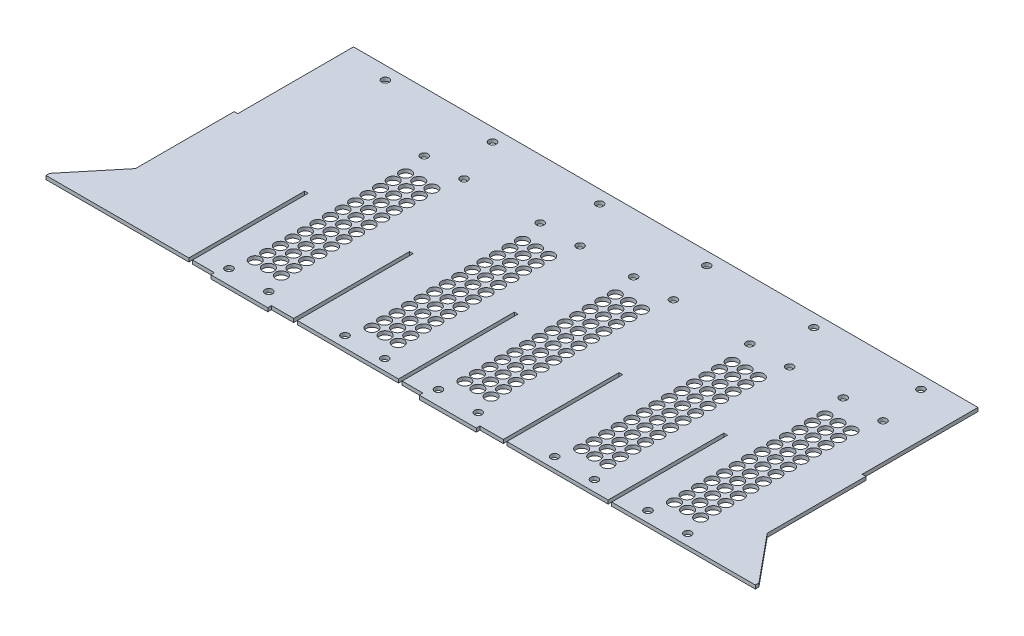
from build123d import *

# Parameters (mm, degrees)
SKETCH1_W                   = 554.2768632
SKETCH1_H                   = 3.175
BOSS_EXTRUDE1_DEPTH         = 232.6
SKETCH7_R                   = 3.302
CUT_EXTRUDE4_DEPTH          = 362.826686267
SKETCH6_W                   = 50
SKETCH6_H                   = 3.175
BOSS_EXTRUDE2_DEPTH         = 3.175
LPATTERN1_COUNT             = 6
LPATTERN1_PITCH             = 93.98
SKETCH2_W                   = 3.175
SKETCH2_H                   = 101.6
CUT_EXTRUDE5_DEPTH          = 364.878219969
BOSS_EXTRUDE3_DEPTH         = 3.175
SKETCH13_R                  = 5
CUT_EXTRUDE6_DEPTH          = 391.42435321
LPATTERN2_COUNT             = 3
LPATTERN2_PITCH             = 11.5
LPATTERN3_COUNT             = 13
LPATTERN3_PITCH             = 11
LPATTERN3_COPY_1_SKETCH_R   = 5
LPATTERN3_COPY_1_DEPTH      = 391.42435321
LPATTERN3_COPY_2_SKETCH_R   = 5
LPATTERN3_COPY_2_DEPTH      = 391.42435321
LPATTERN3_COPY_3_SKETCH_R   = 5
LPATTERN3_COPY_3_DEPTH      = 391.42435321
LPATTERN3_COPY_4_SKETCH_R   = 5
LPATTERN3_COPY_4_DEPTH      = 391.42435321
LPATTERN3_COPY_5_SKETCH_R   = 5
LPATTERN3_COPY_5_DEPTH      = 391.42435321
LPATTERN3_COPY_6_SKETCH_R   = 5
LPATTERN3_COPY_6_DEPTH      = 391.42435321
LPATTERN3_COPY_7_SKETCH_R   = 5
LPATTERN3_COPY_7_DEPTH      = 391.42435321
LPATTERN3_COPY_8_SKETCH_R   = 5
LPATTERN3_COPY_8_DEPTH      = 391.42435321
LPATTERN3_COPY_9_SKETCH_R   = 5
LPATTERN3_COPY_9_DEPTH      = 391.42435321
LPATTERN3_COPY_10_SKETCH_R  = 5
LPATTERN3_COPY_10_DEPTH     = 391.42435321
LPATTERN3_COPY_11_SKETCH_R  = 5
LPATTERN3_COPY_11_DEPTH     = 391.42435321
LPATTERN3_COPY_12_SKETCH_R  = 5
LPATTERN3_COPY_12_DEPTH     = 391.42435321
LPATTERN3_COPY_13_SKETCH_R  = 5
LPATTERN3_COPY_13_DEPTH     = 391.42435321
LPATTERN3_COPY_14_SKETCH_R  = 5
LPATTERN3_COPY_14_DEPTH     = 391.42435321
LPATTERN3_COPY_15_SKETCH_R  = 5
LPATTERN3_COPY_15_DEPTH     = 391.42435321
LPATTERN3_COPY_16_SKETCH_R  = 5
LPATTERN3_COPY_16_DEPTH     = 391.42435321
LPATTERN3_COPY_17_SKETCH_R  = 5
LPATTERN3_COPY_17_DEPTH     = 391.42435321
LPATTERN3_COPY_18_SKETCH_R  = 5
LPATTERN3_COPY_18_DEPTH     = 391.42435321
LPATTERN3_COPY_19_SKETCH_R  = 5
LPATTERN3_COPY_19_DEPTH     = 391.42435321
LPATTERN3_COPY_20_SKETCH_R  = 5
LPATTERN3_COPY_20_DEPTH     = 391.42435321
LPATTERN3_COPY_21_SKETCH_R  = 5
LPATTERN3_COPY_21_DEPTH     = 391.42435321
LPATTERN3_COPY_22_SKETCH_R  = 5
LPATTERN3_COPY_22_DEPTH     = 391.42435321
LPATTERN3_COPY_23_SKETCH_R  = 5
LPATTERN3_COPY_23_DEPTH     = 391.42435321
LPATTERN3_COPY_24_SKETCH_R  = 5
LPATTERN3_COPY_24_DEPTH     = 391.42435321
LPATTERN4_COUNT             = 3
LPATTERN4_PITCH             = 183.92
LPATTERN4_COPY_1_SKETCH_R   = 5
LPATTERN4_COPY_1_DEPTH      = 391.42435321
LPATTERN4_COPY_2_SKETCH_R   = 5
LPATTERN4_COPY_2_DEPTH      = 391.42435321
LPATTERN4_COPY_3_SKETCH_R   = 5
LPATTERN4_COPY_3_DEPTH      = 391.42435321
LPATTERN4_COPY_4_SKETCH_R   = 5
LPATTERN4_COPY_4_DEPTH      = 391.42435321
LPATTERN4_COPY_5_SKETCH_R   = 5
LPATTERN4_COPY_5_DEPTH      = 391.42435321
LPATTERN4_COPY_6_SKETCH_R   = 5
LPATTERN4_COPY_6_DEPTH      = 391.42435321
LPATTERN4_COPY_7_SKETCH_R   = 5
LPATTERN4_COPY_7_DEPTH      = 391.42435321
LPATTERN4_COPY_8_SKETCH_R   = 5
LPATTERN4_COPY_8_DEPTH      = 391.42435321
LPATTERN4_COPY_9_SKETCH_R   = 5
LPATTERN4_COPY_9_DEPTH      = 391.42435321
LPATTERN4_COPY_10_SKETCH_R  = 5
LPATTERN4_COPY_10_DEPTH     = 391.42435321
LPATTERN4_COPY_11_SKETCH_R  = 5
LPATTERN4_COPY_11_DEPTH     = 391.42435321
LPATTERN4_COPY_12_SKETCH_R  = 5
LPATTERN4_COPY_12_DEPTH     = 391.42435321
LPATTERN4_COPY_13_SKETCH_R  = 5
LPATTERN4_COPY_13_DEPTH     = 391.42435321
LPATTERN4_COPY_14_SKETCH_R  = 5
LPATTERN4_COPY_14_DEPTH     = 391.42435321
LPATTERN4_COPY_15_SKETCH_R  = 5
LPATTERN4_COPY_15_DEPTH     = 391.42435321
LPATTERN4_COPY_16_SKETCH_R  = 5
LPATTERN4_COPY_16_DEPTH     = 391.42435321
LPATTERN4_COPY_17_SKETCH_R  = 5
LPATTERN4_COPY_17_DEPTH     = 391.42435321
LPATTERN4_COPY_18_SKETCH_R  = 5
LPATTERN4_COPY_18_DEPTH     = 391.42435321
LPATTERN4_COPY_19_SKETCH_R  = 5
LPATTERN4_COPY_19_DEPTH     = 391.42435321
LPATTERN4_COPY_20_SKETCH_R  = 5
LPATTERN4_COPY_20_DEPTH     = 391.42435321
LPATTERN4_COPY_21_SKETCH_R  = 5
LPATTERN4_COPY_21_DEPTH     = 391.42435321
LPATTERN4_COPY_22_SKETCH_R  = 5
LPATTERN4_COPY_22_DEPTH     = 391.42435321
LPATTERN4_COPY_23_SKETCH_R  = 5
LPATTERN4_COPY_23_DEPTH     = 391.42435321
LPATTERN4_COPY_24_SKETCH_R  = 5
LPATTERN4_COPY_24_DEPTH     = 391.42435321
LPATTERN4_COPY_25_SKETCH_R  = 5
LPATTERN4_COPY_25_DEPTH     = 391.42435321
LPATTERN4_COPY_26_SKETCH_R  = 5
LPATTERN4_COPY_26_DEPTH     = 391.42435321
LPATTERN4_COPY_27_SKETCH_R  = 5
LPATTERN4_COPY_27_DEPTH     = 391.42435321
LPATTERN4_COPY_28_SKETCH_R  = 5
LPATTERN4_COPY_28_DEPTH     = 391.42435321
LPATTERN4_COPY_29_SKETCH_R  = 5
LPATTERN4_COPY_29_DEPTH     = 391.42435321
LPATTERN4_COPY_30_SKETCH_R  = 5
LPATTERN4_COPY_30_DEPTH     = 391.42435321
LPATTERN4_COPY_31_SKETCH_R  = 5
LPATTERN4_COPY_31_DEPTH     = 391.42435321
LPATTERN4_COPY_32_SKETCH_R  = 5
LPATTERN4_COPY_32_DEPTH     = 391.42435321
LPATTERN4_COPY_33_SKETCH_R  = 5
LPATTERN4_COPY_33_DEPTH     = 391.42435321
LPATTERN4_COPY_34_SKETCH_R  = 5
LPATTERN4_COPY_34_DEPTH     = 391.42435321
LPATTERN4_COPY_35_SKETCH_R  = 5
LPATTERN4_COPY_35_DEPTH     = 391.42435321
LPATTERN4_COPY_36_SKETCH_R  = 5
LPATTERN4_COPY_36_DEPTH     = 391.42435321
LPATTERN4_COPY_37_SKETCH_R  = 5
LPATTERN4_COPY_37_DEPTH     = 391.42435321
LPATTERN4_COPY_38_SKETCH_R  = 5
LPATTERN4_COPY_38_DEPTH     = 391.42435321
LPATTERN4_COPY_39_SKETCH_R  = 5
LPATTERN4_COPY_39_DEPTH     = 391.42435321
LPATTERN4_COPY_40_SKETCH_R  = 5
LPATTERN4_COPY_40_DEPTH     = 391.42435321
LPATTERN4_COPY_41_SKETCH_R  = 5
LPATTERN4_COPY_41_DEPTH     = 391.42435321
LPATTERN4_COPY_42_SKETCH_R  = 5
LPATTERN4_COPY_42_DEPTH     = 391.42435321
LPATTERN4_COPY_43_SKETCH_R  = 5
LPATTERN4_COPY_43_DEPTH     = 391.42435321
LPATTERN4_COPY_44_SKETCH_R  = 5
LPATTERN4_COPY_44_DEPTH     = 391.42435321
LPATTERN4_COPY_45_SKETCH_R  = 5
LPATTERN4_COPY_45_DEPTH     = 391.42435321
LPATTERN4_COPY_46_SKETCH_R  = 5
LPATTERN4_COPY_46_DEPTH     = 391.42435321
LPATTERN4_COPY_47_SKETCH_R  = 5
LPATTERN4_COPY_47_DEPTH     = 391.42435321
LPATTERN4_COPY_48_SKETCH_R  = 5
LPATTERN4_COPY_48_DEPTH     = 391.42435321
LPATTERN4_COPY_49_SKETCH_R  = 5
LPATTERN4_COPY_49_DEPTH     = 391.42435321
LPATTERN4_COPY_50_SKETCH_R  = 5
LPATTERN4_COPY_50_DEPTH     = 391.42435321
LPATTERN4_COPY_51_SKETCH_R  = 5
LPATTERN4_COPY_51_DEPTH     = 391.42435321
LPATTERN4_COPY_52_SKETCH_R  = 5
LPATTERN4_COPY_52_DEPTH     = 391.42435321
LPATTERN4_COPY_53_SKETCH_R  = 5
LPATTERN4_COPY_53_DEPTH     = 391.42435321
LPATTERN4_COPY_54_SKETCH_R  = 5
LPATTERN4_COPY_54_DEPTH     = 391.42435321
LPATTERN4_COPY_55_SKETCH_R  = 5
LPATTERN4_COPY_55_DEPTH     = 391.42435321
LPATTERN4_COPY_56_SKETCH_R  = 5
LPATTERN4_COPY_56_DEPTH     = 391.42435321
LPATTERN4_COPY_57_SKETCH_R  = 5
LPATTERN4_COPY_57_DEPTH     = 391.42435321
LPATTERN4_COPY_58_SKETCH_R  = 5
LPATTERN4_COPY_58_DEPTH     = 391.42435321
LPATTERN4_COPY_59_SKETCH_R  = 5
LPATTERN4_COPY_59_DEPTH     = 391.42435321
LPATTERN4_COPY_60_SKETCH_R  = 5
LPATTERN4_COPY_60_DEPTH     = 391.42435321
LPATTERN4_COPY_61_SKETCH_R  = 5
LPATTERN4_COPY_61_DEPTH     = 391.42435321
LPATTERN4_COPY_62_SKETCH_R  = 5
LPATTERN4_COPY_62_DEPTH     = 391.42435321
LPATTERN4_COPY_63_SKETCH_R  = 5
LPATTERN4_COPY_63_DEPTH     = 391.42435321
LPATTERN4_COPY_64_SKETCH_R  = 5
LPATTERN4_COPY_64_DEPTH     = 391.42435321
LPATTERN4_COPY_65_SKETCH_R  = 5
LPATTERN4_COPY_65_DEPTH     = 391.42435321
LPATTERN4_COPY_66_SKETCH_R  = 5
LPATTERN4_COPY_66_DEPTH     = 391.42435321
LPATTERN4_COPY_67_SKETCH_R  = 5
LPATTERN4_COPY_67_DEPTH     = 391.42435321
LPATTERN4_COPY_68_SKETCH_R  = 5
LPATTERN4_COPY_68_DEPTH     = 391.42435321
LPATTERN4_COPY_69_SKETCH_R  = 5
LPATTERN4_COPY_69_DEPTH     = 391.42435321
LPATTERN4_COPY_70_SKETCH_R  = 5
LPATTERN4_COPY_70_DEPTH     = 391.42435321
LPATTERN4_COPY_71_SKETCH_R  = 5
LPATTERN4_COPY_71_DEPTH     = 391.42435321
LPATTERN4_COPY_72_SKETCH_R  = 5
LPATTERN4_COPY_72_DEPTH     = 391.42435321
LPATTERN4_COPY_73_SKETCH_R  = 5
LPATTERN4_COPY_73_DEPTH     = 391.42435321
LPATTERN4_COPY_74_SKETCH_R  = 5
LPATTERN4_COPY_74_DEPTH     = 391.42435321
LPATTERN4_COPY_75_SKETCH_R  = 5
LPATTERN4_COPY_75_DEPTH     = 391.42435321
LPATTERN4_COPY_76_SKETCH_R  = 5
LPATTERN4_COPY_76_DEPTH     = 391.42435321
SKETCH14_W                  = 3.175
SKETCH14_H                  = 101.6
CUT_EXTRUDE7_DEPTH          = 391.42435321
LPATTERN7_COUNT             = 5
LPATTERN7_PITCH             = 91.9550104
SKETCH21_R                  = 5
CUT_EXTRUDE8_DEPTH          = 391.42435321
LPATTERN10_COUNT            = 13
LPATTERN10_PITCH            = 11
LPATTERN11_COUNT            = 2
LPATTERN11_PITCH            = 183.92
LPATTERN11_COPY_1_SKETCH_R  = 5
LPATTERN11_COPY_1_DEPTH     = 391.42435321
LPATTERN11_COPY_2_SKETCH_R  = 5
LPATTERN11_COPY_2_DEPTH     = 391.42435321
LPATTERN11_COPY_3_SKETCH_R  = 5
LPATTERN11_COPY_3_DEPTH     = 391.42435321
LPATTERN11_COPY_4_SKETCH_R  = 5
LPATTERN11_COPY_4_DEPTH     = 391.42435321
LPATTERN11_COPY_5_SKETCH_R  = 5
LPATTERN11_COPY_5_DEPTH     = 391.42435321
LPATTERN11_COPY_6_SKETCH_R  = 5
LPATTERN11_COPY_6_DEPTH     = 391.42435321
LPATTERN11_COPY_7_SKETCH_R  = 5
LPATTERN11_COPY_7_DEPTH     = 391.42435321
LPATTERN11_COPY_8_SKETCH_R  = 5
LPATTERN11_COPY_8_DEPTH     = 391.42435321
LPATTERN11_COPY_9_SKETCH_R  = 5
LPATTERN11_COPY_9_DEPTH     = 391.42435321
LPATTERN11_COPY_10_SKETCH_R = 5
LPATTERN11_COPY_10_DEPTH    = 391.42435321
LPATTERN11_COPY_11_SKETCH_R = 5
LPATTERN11_COPY_11_DEPTH    = 391.42435321
LPATTERN11_COPY_12_SKETCH_R = 5
LPATTERN11_COPY_12_DEPTH    = 391.42435321
M6_CLEARANCE_HOLE2_D        = 6.6
LPATTERN12_COUNT            = 2
LPATTERN12_PITCH            = 183.896
M6_CLEARANCE_HOLE3_D        = 6.6


with BuildPart() as part:
    # Sketch1 → Boss-Extrude1 (new body)
    with BuildSketch(Plane.XY):
        Rectangle(SKETCH1_W, SKETCH1_H)
    extrude(amount=BOSS_EXTRUDE1_DEPTH)

    # Sketch7 → Cut-Extrude4 (cut, through all)
    with BuildSketch(Plane(origin=(0, -1.5875, 0), x_dir=(-1, 0, 0), z_dir=(0, -1, 0))):
        with Locations(Location((-235.2284316, -11.29165, 0), (0, 0, 90))):
            Circle(SKETCH7_R)
    cut_extrude4 = extrude(amount=-CUT_EXTRUDE4_DEPTH, mode=Mode.SUBTRACT)

    # Sketch6 → Boss-Extrude2 (add)
    with BuildSketch(Plane.XY.offset(232.6)):
        with Locations((-138.4246374, 0)):
            Rectangle(SKETCH6_W, SKETCH6_H)
        Polygon((69.533389644, -1.5875), (69.533389644, 1.5875), (19.533389644, 1.5875), (19.533389644, -1.847332285), align=None)
    extrude(amount=BOSS_EXTRUDE2_DEPTH)

    # LPattern1: Cut-Extrude4 ×6
    with Locations(*[(-i * LPATTERN1_PITCH, 0, 0) for i in range(1, LPATTERN1_COUNT)]):
        add(cut_extrude4, mode=Mode.SUBTRACT)

    # Sketch2 → Cut-Extrude5 (cut, through all)
    with BuildSketch(Plane(origin=(0, 1.5875, 0), x_dir=(1, 0, 0), z_dir=(0, 1, 0))):
        with Locations((-275.5509316, -50.8)):
            Rectangle(SKETCH2_W, SKETCH2_H)
        with Locations((275.5509316, -50.8)):
            Rectangle(SKETCH2_W, SKETCH2_H)
    extrude(amount=-CUT_EXTRUDE5_DEPTH, mode=Mode.SUBTRACT)

    # Sketch12 → Boss-Extrude3 (add)
    with BuildSketch(Plane(origin=(0, 1.5875, 0), x_dir=(1, 0, 0), z_dir=(0, 1, 0))):
        Polygon((-311.1744316, -232.6), (-277.1384316, -232.6), (-277.1384316, -188.15), (-311.1744316, -229.425), align=None)
    boss_extrude3 = extrude(amount=-BOSS_EXTRUDE3_DEPTH)

    # Mirror1: Boss-Extrude3 across plane
    add(boss_extrude3.mirror(Plane(origin=(0, 0, 0), x_dir=(0, 0, 1), z_dir=(1, 0, 0))))

    # Sketch13 → Cut-Extrude6 (cut, through all)
    with BuildSketch(Plane(origin=(0, 1.5875, 0), x_dir=(1, 0, 0), z_dir=(0, 1, 0))):
        with Locations(Location((-154.856502919, -73.343337061, 0), (0, 0, 270))):
            Circle(SKETCH13_R)
    cut_extrude6 = extrude(amount=-CUT_EXTRUDE6_DEPTH, mode=Mode.SUBTRACT)

    # LPattern2: Cut-Extrude6 ×3
    with Locations(*[(i * LPATTERN2_PITCH, 0, 0) for i in range(1, LPATTERN2_COUNT)]):
        add(cut_extrude6, mode=Mode.SUBTRACT)

    # LPattern3: Cut-Extrude6 ×13
    with Locations(*[(0, 0, i * LPATTERN3_PITCH) for i in range(1, LPATTERN3_COUNT)]):
        add(cut_extrude6, mode=Mode.SUBTRACT)

    # LPattern3 copy 1 sketch → LPattern3 copy 1 (cut, through all)
    with BuildSketch(Plane(origin=(11.5, 1.5875, 11), x_dir=(1, 0, 0), z_dir=(0, 1, 0))):
        with Locations(Location((-154.856502919, -73.343337061, 0), (0, 0, 270))):
            Circle(LPATTERN3_COPY_1_SKETCH_R)
    extrude(amount=-LPATTERN3_COPY_1_DEPTH, mode=Mode.SUBTRACT)

    # LPattern3 copy 2 sketch → LPattern3 copy 2 (cut, through all)
    with BuildSketch(Plane(origin=(11.5, 1.5875, 22), x_dir=(1, 0, 0), z_dir=(0, 1, 0))):
        with Locations(Location((-154.856502919, -73.343337061, 0), (0, 0, 270))):
            Circle(LPATTERN3_COPY_2_SKETCH_R)
    extrude(amount=-LPATTERN3_COPY_2_DEPTH, mode=Mode.SUBTRACT)

    # LPattern3 copy 3 sketch → LPattern3 copy 3 (cut, through all)
    with BuildSketch(Plane(origin=(11.5, 1.5875, 33), x_dir=(1, 0, 0), z_dir=(0, 1, 0))):
        with Locations(Location((-154.856502919, -73.343337061, 0), (0, 0, 270))):
            Circle(LPATTERN3_COPY_3_SKETCH_R)
    extrude(amount=-LPATTERN3_COPY_3_DEPTH, mode=Mode.SUBTRACT)

    # LPattern3 copy 4 sketch → LPattern3 copy 4 (cut, through all)
    with BuildSketch(Plane(origin=(11.5, 1.5875, 44), x_dir=(1, 0, 0), z_dir=(0, 1, 0))):
        with Locations(Location((-154.856502919, -73.343337061, 0), (0, 0, 270))):
            Circle(LPATTERN3_COPY_4_SKETCH_R)
    extrude(amount=-LPATTERN3_COPY_4_DEPTH, mode=Mode.SUBTRACT)

    # LPattern3 copy 5 sketch → LPattern3 copy 5 (cut, through all)
    with BuildSketch(Plane(origin=(11.5, 1.5875, 55), x_dir=(1, 0, 0), z_dir=(0, 1, 0))):
        with Locations(Location((-154.856502919, -73.343337061, 0), (0, 0, 270))):
            Circle(LPATTERN3_COPY_5_SKETCH_R)
    extrude(amount=-LPATTERN3_COPY_5_DEPTH, mode=Mode.SUBTRACT)

    # LPattern3 copy 6 sketch → LPattern3 copy 6 (cut, through all)
    with BuildSketch(Plane(origin=(11.5, 1.5875, 66), x_dir=(1, 0, 0), z_dir=(0, 1, 0))):
        with Locations(Location((-154.856502919, -73.343337061, 0), (0, 0, 270))):
            Circle(LPATTERN3_COPY_6_SKETCH_R)
    extrude(amount=-LPATTERN3_COPY_6_DEPTH, mode=Mode.SUBTRACT)

    # LPattern3 copy 7 sketch → LPattern3 copy 7 (cut, through all)
    with BuildSketch(Plane(origin=(11.5, 1.5875, 77), x_dir=(1, 0, 0), z_dir=(0, 1, 0))):
        with Locations(Location((-154.856502919, -73.343337061, 0), (0, 0, 270))):
            Circle(LPATTERN3_COPY_7_SKETCH_R)
    extrude(amount=-LPATTERN3_COPY_7_DEPTH, mode=Mode.SUBTRACT)

    # LPattern3 copy 8 sketch → LPattern3 copy 8 (cut, through all)
    with BuildSketch(Plane(origin=(11.5, 1.5875, 88), x_dir=(1, 0, 0), z_dir=(0, 1, 0))):
        with Locations(Location((-154.856502919, -73.343337061, 0), (0, 0, 270))):
            Circle(LPATTERN3_COPY_8_SKETCH_R)
    extrude(amount=-LPATTERN3_COPY_8_DEPTH, mode=Mode.SUBTRACT)

    # LPattern3 copy 9 sketch → LPattern3 copy 9 (cut, through all)
    with BuildSketch(Plane(origin=(11.5, 1.5875, 99), x_dir=(1, 0, 0), z_dir=(0, 1, 0))):
        with Locations(Location((-154.856502919, -73.343337061, 0), (0, 0, 270))):
            Circle(LPATTERN3_COPY_9_SKETCH_R)
    extrude(amount=-LPATTERN3_COPY_9_DEPTH, mode=Mode.SUBTRACT)

    # LPattern3 copy 10 sketch → LPattern3 copy 10 (cut, through all)
    with BuildSketch(Plane(origin=(11.5, 1.5875, 110), x_dir=(1, 0, 0), z_dir=(0, 1, 0))):
        with Locations(Location((-154.856502919, -73.343337061, 0), (0, 0, 270))):
            Circle(LPATTERN3_COPY_10_SKETCH_R)
    extrude(amount=-LPATTERN3_COPY_10_DEPTH, mode=Mode.SUBTRACT)

    # LPattern3 copy 11 sketch → LPattern3 copy 11 (cut, through all)
    with BuildSketch(Plane(origin=(11.5, 1.5875, 121), x_dir=(1, 0, 0), z_dir=(0, 1, 0))):
        with Locations(Location((-154.856502919, -73.343337061, 0), (0, 0, 270))):
            Circle(LPATTERN3_COPY_11_SKETCH_R)
    extrude(amount=-LPATTERN3_COPY_11_DEPTH, mode=Mode.SUBTRACT)

    # LPattern3 copy 12 sketch → LPattern3 copy 12 (cut, through all)
    with BuildSketch(Plane(origin=(11.5, 1.5875, 132), x_dir=(1, 0, 0), z_dir=(0, 1, 0))):
        with Locations(Location((-154.856502919, -73.343337061, 0), (0, 0, 270))):
            Circle(LPATTERN3_COPY_12_SKETCH_R)
    extrude(amount=-LPATTERN3_COPY_12_DEPTH, mode=Mode.SUBTRACT)

    # LPattern3 copy 13 sketch → LPattern3 copy 13 (cut, through all)
    with BuildSketch(Plane(origin=(23, 1.5875, 11), x_dir=(1, 0, 0), z_dir=(0, 1, 0))):
        with Locations(Location((-154.856502919, -73.343337061, 0), (0, 0, 270))):
            Circle(LPATTERN3_COPY_13_SKETCH_R)
    extrude(amount=-LPATTERN3_COPY_13_DEPTH, mode=Mode.SUBTRACT)

    # LPattern3 copy 14 sketch → LPattern3 copy 14 (cut, through all)
    with BuildSketch(Plane(origin=(23, 1.5875, 22), x_dir=(1, 0, 0), z_dir=(0, 1, 0))):
        with Locations(Location((-154.856502919, -73.343337061, 0), (0, 0, 270))):
            Circle(LPATTERN3_COPY_14_SKETCH_R)
    extrude(amount=-LPATTERN3_COPY_14_DEPTH, mode=Mode.SUBTRACT)

    # LPattern3 copy 15 sketch → LPattern3 copy 15 (cut, through all)
    with BuildSketch(Plane(origin=(23, 1.5875, 33), x_dir=(1, 0, 0), z_dir=(0, 1, 0))):
        with Locations(Location((-154.856502919, -73.343337061, 0), (0, 0, 270))):
            Circle(LPATTERN3_COPY_15_SKETCH_R)
    extrude(amount=-LPATTERN3_COPY_15_DEPTH, mode=Mode.SUBTRACT)

    # LPattern3 copy 16 sketch → LPattern3 copy 16 (cut, through all)
    with BuildSketch(Plane(origin=(23, 1.5875, 44), x_dir=(1, 0, 0), z_dir=(0, 1, 0))):
        with Locations(Location((-154.856502919, -73.343337061, 0), (0, 0, 270))):
            Circle(LPATTERN3_COPY_16_SKETCH_R)
    extrude(amount=-LPATTERN3_COPY_16_DEPTH, mode=Mode.SUBTRACT)

    # LPattern3 copy 17 sketch → LPattern3 copy 17 (cut, through all)
    with BuildSketch(Plane(origin=(23, 1.5875, 55), x_dir=(1, 0, 0), z_dir=(0, 1, 0))):
        with Locations(Location((-154.856502919, -73.343337061, 0), (0, 0, 270))):
            Circle(LPATTERN3_COPY_17_SKETCH_R)
    extrude(amount=-LPATTERN3_COPY_17_DEPTH, mode=Mode.SUBTRACT)

    # LPattern3 copy 18 sketch → LPattern3 copy 18 (cut, through all)
    with BuildSketch(Plane(origin=(23, 1.5875, 66), x_dir=(1, 0, 0), z_dir=(0, 1, 0))):
        with Locations(Location((-154.856502919, -73.343337061, 0), (0, 0, 270))):
            Circle(LPATTERN3_COPY_18_SKETCH_R)
    extrude(amount=-LPATTERN3_COPY_18_DEPTH, mode=Mode.SUBTRACT)

    # LPattern3 copy 19 sketch → LPattern3 copy 19 (cut, through all)
    with BuildSketch(Plane(origin=(23, 1.5875, 77), x_dir=(1, 0, 0), z_dir=(0, 1, 0))):
        with Locations(Location((-154.856502919, -73.343337061, 0), (0, 0, 270))):
            Circle(LPATTERN3_COPY_19_SKETCH_R)
    extrude(amount=-LPATTERN3_COPY_19_DEPTH, mode=Mode.SUBTRACT)

    # LPattern3 copy 20 sketch → LPattern3 copy 20 (cut, through all)
    with BuildSketch(Plane(origin=(23, 1.5875, 88), x_dir=(1, 0, 0), z_dir=(0, 1, 0))):
        with Locations(Location((-154.856502919, -73.343337061, 0), (0, 0, 270))):
            Circle(LPATTERN3_COPY_20_SKETCH_R)
    extrude(amount=-LPATTERN3_COPY_20_DEPTH, mode=Mode.SUBTRACT)

    # LPattern3 copy 21 sketch → LPattern3 copy 21 (cut, through all)
    with BuildSketch(Plane(origin=(23, 1.5875, 99), x_dir=(1, 0, 0), z_dir=(0, 1, 0))):
        with Locations(Location((-154.856502919, -73.343337061, 0), (0, 0, 270))):
            Circle(LPATTERN3_COPY_21_SKETCH_R)
    extrude(amount=-LPATTERN3_COPY_21_DEPTH, mode=Mode.SUBTRACT)

    # LPattern3 copy 22 sketch → LPattern3 copy 22 (cut, through all)
    with BuildSketch(Plane(origin=(23, 1.5875, 110), x_dir=(1, 0, 0), z_dir=(0, 1, 0))):
        with Locations(Location((-154.856502919, -73.343337061, 0), (0, 0, 270))):
            Circle(LPATTERN3_COPY_22_SKETCH_R)
    extrude(amount=-LPATTERN3_COPY_22_DEPTH, mode=Mode.SUBTRACT)

    # LPattern3 copy 23 sketch → LPattern3 copy 23 (cut, through all)
    with BuildSketch(Plane(origin=(23, 1.5875, 121), x_dir=(1, 0, 0), z_dir=(0, 1, 0))):
        with Locations(Location((-154.856502919, -73.343337061, 0), (0, 0, 270))):
            Circle(LPATTERN3_COPY_23_SKETCH_R)
    extrude(amount=-LPATTERN3_COPY_23_DEPTH, mode=Mode.SUBTRACT)

    # LPattern3 copy 24 sketch → LPattern3 copy 24 (cut, through all)
    with BuildSketch(Plane(origin=(23, 1.5875, 132), x_dir=(1, 0, 0), z_dir=(0, 1, 0))):
        with Locations(Location((-154.856502919, -73.343337061, 0), (0, 0, 270))):
            Circle(LPATTERN3_COPY_24_SKETCH_R)
    extrude(amount=-LPATTERN3_COPY_24_DEPTH, mode=Mode.SUBTRACT)

    # LPattern4: Cut-Extrude6 ×3
    with Locations(*[(i * LPATTERN4_PITCH, 0, 0) for i in range(1, LPATTERN4_COUNT)]):
        add(cut_extrude6, mode=Mode.SUBTRACT)

    # LPattern4 copy 1 sketch → LPattern4 copy 1 (cut, through all)
    with BuildSketch(Plane(origin=(195.42, 1.5875, 0), x_dir=(1, 0, 0), z_dir=(0, 1, 0))):
        with Locations(Location((-154.856502919, -73.343337061, 0), (0, 0, 270))):
            Circle(LPATTERN4_COPY_1_SKETCH_R)
    extrude(amount=-LPATTERN4_COPY_1_DEPTH, mode=Mode.SUBTRACT)

    # LPattern4 copy 2 sketch → LPattern4 copy 2 (cut, through all)
    with BuildSketch(Plane(origin=(379.34, 1.5875, 0), x_dir=(1, 0, 0), z_dir=(0, 1, 0))):
        with Locations(Location((-154.856502919, -73.343337061, 0), (0, 0, 270))):
            Circle(LPATTERN4_COPY_2_SKETCH_R)
    extrude(amount=-LPATTERN4_COPY_2_DEPTH, mode=Mode.SUBTRACT)

    # LPattern4 copy 3 sketch → LPattern4 copy 3 (cut, through all)
    with BuildSketch(Plane(origin=(206.92, 1.5875, 0), x_dir=(1, 0, 0), z_dir=(0, 1, 0))):
        with Locations(Location((-154.856502919, -73.343337061, 0), (0, 0, 270))):
            Circle(LPATTERN4_COPY_3_SKETCH_R)
    extrude(amount=-LPATTERN4_COPY_3_DEPTH, mode=Mode.SUBTRACT)

    # LPattern4 copy 4 sketch → LPattern4 copy 4 (cut, through all)
    with BuildSketch(Plane(origin=(390.84, 1.5875, 0), x_dir=(1, 0, 0), z_dir=(0, 1, 0))):
        with Locations(Location((-154.856502919, -73.343337061, 0), (0, 0, 270))):
            Circle(LPATTERN4_COPY_4_SKETCH_R)
    extrude(amount=-LPATTERN4_COPY_4_DEPTH, mode=Mode.SUBTRACT)

    # LPattern4 copy 5 sketch → LPattern4 copy 5 (cut, through all)
    with BuildSketch(Plane(origin=(183.92, 1.5875, 11), x_dir=(1, 0, 0), z_dir=(0, 1, 0))):
        with Locations(Location((-154.856502919, -73.343337061, 0), (0, 0, 270))):
            Circle(LPATTERN4_COPY_5_SKETCH_R)
    extrude(amount=-LPATTERN4_COPY_5_DEPTH, mode=Mode.SUBTRACT)

    # LPattern4 copy 6 sketch → LPattern4 copy 6 (cut, through all)
    with BuildSketch(Plane(origin=(367.84, 1.5875, 11), x_dir=(1, 0, 0), z_dir=(0, 1, 0))):
        with Locations(Location((-154.856502919, -73.343337061, 0), (0, 0, 270))):
            Circle(LPATTERN4_COPY_6_SKETCH_R)
    extrude(amount=-LPATTERN4_COPY_6_DEPTH, mode=Mode.SUBTRACT)

    # LPattern4 copy 7 sketch → LPattern4 copy 7 (cut, through all)
    with BuildSketch(Plane(origin=(183.92, 1.5875, 22), x_dir=(1, 0, 0), z_dir=(0, 1, 0))):
        with Locations(Location((-154.856502919, -73.343337061, 0), (0, 0, 270))):
            Circle(LPATTERN4_COPY_7_SKETCH_R)
    extrude(amount=-LPATTERN4_COPY_7_DEPTH, mode=Mode.SUBTRACT)

    # LPattern4 copy 8 sketch → LPattern4 copy 8 (cut, through all)
    with BuildSketch(Plane(origin=(367.84, 1.5875, 22), x_dir=(1, 0, 0), z_dir=(0, 1, 0))):
        with Locations(Location((-154.856502919, -73.343337061, 0), (0, 0, 270))):
            Circle(LPATTERN4_COPY_8_SKETCH_R)
    extrude(amount=-LPATTERN4_COPY_8_DEPTH, mode=Mode.SUBTRACT)

    # LPattern4 copy 9 sketch → LPattern4 copy 9 (cut, through all)
    with BuildSketch(Plane(origin=(183.92, 1.5875, 33), x_dir=(1, 0, 0), z_dir=(0, 1, 0))):
        with Locations(Location((-154.856502919, -73.343337061, 0), (0, 0, 270))):
            Circle(LPATTERN4_COPY_9_SKETCH_R)
    extrude(amount=-LPATTERN4_COPY_9_DEPTH, mode=Mode.SUBTRACT)

    # LPattern4 copy 10 sketch → LPattern4 copy 10 (cut, through all)
    with BuildSketch(Plane(origin=(367.84, 1.5875, 33), x_dir=(1, 0, 0), z_dir=(0, 1, 0))):
        with Locations(Location((-154.856502919, -73.343337061, 0), (0, 0, 270))):
            Circle(LPATTERN4_COPY_10_SKETCH_R)
    extrude(amount=-LPATTERN4_COPY_10_DEPTH, mode=Mode.SUBTRACT)

    # LPattern4 copy 11 sketch → LPattern4 copy 11 (cut, through all)
    with BuildSketch(Plane(origin=(183.92, 1.5875, 44), x_dir=(1, 0, 0), z_dir=(0, 1, 0))):
        with Locations(Location((-154.856502919, -73.343337061, 0), (0, 0, 270))):
            Circle(LPATTERN4_COPY_11_SKETCH_R)
    extrude(amount=-LPATTERN4_COPY_11_DEPTH, mode=Mode.SUBTRACT)

    # LPattern4 copy 12 sketch → LPattern4 copy 12 (cut, through all)
    with BuildSketch(Plane(origin=(367.84, 1.5875, 44), x_dir=(1, 0, 0), z_dir=(0, 1, 0))):
        with Locations(Location((-154.856502919, -73.343337061, 0), (0, 0, 270))):
            Circle(LPATTERN4_COPY_12_SKETCH_R)
    extrude(amount=-LPATTERN4_COPY_12_DEPTH, mode=Mode.SUBTRACT)

    # LPattern4 copy 13 sketch → LPattern4 copy 13 (cut, through all)
    with BuildSketch(Plane(origin=(183.92, 1.5875, 55), x_dir=(1, 0, 0), z_dir=(0, 1, 0))):
        with Locations(Location((-154.856502919, -73.343337061, 0), (0, 0, 270))):
            Circle(LPATTERN4_COPY_13_SKETCH_R)
    extrude(amount=-LPATTERN4_COPY_13_DEPTH, mode=Mode.SUBTRACT)

    # LPattern4 copy 14 sketch → LPattern4 copy 14 (cut, through all)
    with BuildSketch(Plane(origin=(367.84, 1.5875, 55), x_dir=(1, 0, 0), z_dir=(0, 1, 0))):
        with Locations(Location((-154.856502919, -73.343337061, 0), (0, 0, 270))):
            Circle(LPATTERN4_COPY_14_SKETCH_R)
    extrude(amount=-LPATTERN4_COPY_14_DEPTH, mode=Mode.SUBTRACT)

    # LPattern4 copy 15 sketch → LPattern4 copy 15 (cut, through all)
    with BuildSketch(Plane(origin=(183.92, 1.5875, 66), x_dir=(1, 0, 0), z_dir=(0, 1, 0))):
        with Locations(Location((-154.856502919, -73.343337061, 0), (0, 0, 270))):
            Circle(LPATTERN4_COPY_15_SKETCH_R)
    extrude(amount=-LPATTERN4_COPY_15_DEPTH, mode=Mode.SUBTRACT)

    # LPattern4 copy 16 sketch → LPattern4 copy 16 (cut, through all)
    with BuildSketch(Plane(origin=(367.84, 1.5875, 66), x_dir=(1, 0, 0), z_dir=(0, 1, 0))):
        with Locations(Location((-154.856502919, -73.343337061, 0), (0, 0, 270))):
            Circle(LPATTERN4_COPY_16_SKETCH_R)
    extrude(amount=-LPATTERN4_COPY_16_DEPTH, mode=Mode.SUBTRACT)

    # LPattern4 copy 17 sketch → LPattern4 copy 17 (cut, through all)
    with BuildSketch(Plane(origin=(183.92, 1.5875, 77), x_dir=(1, 0, 0), z_dir=(0, 1, 0))):
        with Locations(Location((-154.856502919, -73.343337061, 0), (0, 0, 270))):
            Circle(LPATTERN4_COPY_17_SKETCH_R)
    extrude(amount=-LPATTERN4_COPY_17_DEPTH, mode=Mode.SUBTRACT)

    # LPattern4 copy 18 sketch → LPattern4 copy 18 (cut, through all)
    with BuildSketch(Plane(origin=(367.84, 1.5875, 77), x_dir=(1, 0, 0), z_dir=(0, 1, 0))):
        with Locations(Location((-154.856502919, -73.343337061, 0), (0, 0, 270))):
            Circle(LPATTERN4_COPY_18_SKETCH_R)
    extrude(amount=-LPATTERN4_COPY_18_DEPTH, mode=Mode.SUBTRACT)

    # LPattern4 copy 19 sketch → LPattern4 copy 19 (cut, through all)
    with BuildSketch(Plane(origin=(183.92, 1.5875, 88), x_dir=(1, 0, 0), z_dir=(0, 1, 0))):
        with Locations(Location((-154.856502919, -73.343337061, 0), (0, 0, 270))):
            Circle(LPATTERN4_COPY_19_SKETCH_R)
    extrude(amount=-LPATTERN4_COPY_19_DEPTH, mode=Mode.SUBTRACT)

    # LPattern4 copy 20 sketch → LPattern4 copy 20 (cut, through all)
    with BuildSketch(Plane(origin=(367.84, 1.5875, 88), x_dir=(1, 0, 0), z_dir=(0, 1, 0))):
        with Locations(Location((-154.856502919, -73.343337061, 0), (0, 0, 270))):
            Circle(LPATTERN4_COPY_20_SKETCH_R)
    extrude(amount=-LPATTERN4_COPY_20_DEPTH, mode=Mode.SUBTRACT)

    # LPattern4 copy 21 sketch → LPattern4 copy 21 (cut, through all)
    with BuildSketch(Plane(origin=(183.92, 1.5875, 99), x_dir=(1, 0, 0), z_dir=(0, 1, 0))):
        with Locations(Location((-154.856502919, -73.343337061, 0), (0, 0, 270))):
            Circle(LPATTERN4_COPY_21_SKETCH_R)
    extrude(amount=-LPATTERN4_COPY_21_DEPTH, mode=Mode.SUBTRACT)

    # LPattern4 copy 22 sketch → LPattern4 copy 22 (cut, through all)
    with BuildSketch(Plane(origin=(367.84, 1.5875, 99), x_dir=(1, 0, 0), z_dir=(0, 1, 0))):
        with Locations(Location((-154.856502919, -73.343337061, 0), (0, 0, 270))):
            Circle(LPATTERN4_COPY_22_SKETCH_R)
    extrude(amount=-LPATTERN4_COPY_22_DEPTH, mode=Mode.SUBTRACT)

    # LPattern4 copy 23 sketch → LPattern4 copy 23 (cut, through all)
    with BuildSketch(Plane(origin=(183.92, 1.5875, 110), x_dir=(1, 0, 0), z_dir=(0, 1, 0))):
        with Locations(Location((-154.856502919, -73.343337061, 0), (0, 0, 270))):
            Circle(LPATTERN4_COPY_23_SKETCH_R)
    extrude(amount=-LPATTERN4_COPY_23_DEPTH, mode=Mode.SUBTRACT)

    # LPattern4 copy 24 sketch → LPattern4 copy 24 (cut, through all)
    with BuildSketch(Plane(origin=(367.84, 1.5875, 110), x_dir=(1, 0, 0), z_dir=(0, 1, 0))):
        with Locations(Location((-154.856502919, -73.343337061, 0), (0, 0, 270))):
            Circle(LPATTERN4_COPY_24_SKETCH_R)
    extrude(amount=-LPATTERN4_COPY_24_DEPTH, mode=Mode.SUBTRACT)

    # LPattern4 copy 25 sketch → LPattern4 copy 25 (cut, through all)
    with BuildSketch(Plane(origin=(183.92, 1.5875, 121), x_dir=(1, 0, 0), z_dir=(0, 1, 0))):
        with Locations(Location((-154.856502919, -73.343337061, 0), (0, 0, 270))):
            Circle(LPATTERN4_COPY_25_SKETCH_R)
    extrude(amount=-LPATTERN4_COPY_25_DEPTH, mode=Mode.SUBTRACT)

    # LPattern4 copy 26 sketch → LPattern4 copy 26 (cut, through all)
    with BuildSketch(Plane(origin=(367.84, 1.5875, 121), x_dir=(1, 0, 0), z_dir=(0, 1, 0))):
        with Locations(Location((-154.856502919, -73.343337061, 0), (0, 0, 270))):
            Circle(LPATTERN4_COPY_26_SKETCH_R)
    extrude(amount=-LPATTERN4_COPY_26_DEPTH, mode=Mode.SUBTRACT)

    # LPattern4 copy 27 sketch → LPattern4 copy 27 (cut, through all)
    with BuildSketch(Plane(origin=(183.92, 1.5875, 132), x_dir=(1, 0, 0), z_dir=(0, 1, 0))):
        with Locations(Location((-154.856502919, -73.343337061, 0), (0, 0, 270))):
            Circle(LPATTERN4_COPY_27_SKETCH_R)
    extrude(amount=-LPATTERN4_COPY_27_DEPTH, mode=Mode.SUBTRACT)

    # LPattern4 copy 28 sketch → LPattern4 copy 28 (cut, through all)
    with BuildSketch(Plane(origin=(367.84, 1.5875, 132), x_dir=(1, 0, 0), z_dir=(0, 1, 0))):
        with Locations(Location((-154.856502919, -73.343337061, 0), (0, 0, 270))):
            Circle(LPATTERN4_COPY_28_SKETCH_R)
    extrude(amount=-LPATTERN4_COPY_28_DEPTH, mode=Mode.SUBTRACT)

    # LPattern4 copy 29 sketch → LPattern4 copy 29 (cut, through all)
    with BuildSketch(Plane(origin=(195.42, 1.5875, 11), x_dir=(1, 0, 0), z_dir=(0, 1, 0))):
        with Locations(Location((-154.856502919, -73.343337061, 0), (0, 0, 270))):
            Circle(LPATTERN4_COPY_29_SKETCH_R)
    extrude(amount=-LPATTERN4_COPY_29_DEPTH, mode=Mode.SUBTRACT)

    # LPattern4 copy 30 sketch → LPattern4 copy 30 (cut, through all)
    with BuildSketch(Plane(origin=(379.34, 1.5875, 11), x_dir=(1, 0, 0), z_dir=(0, 1, 0))):
        with Locations(Location((-154.856502919, -73.343337061, 0), (0, 0, 270))):
            Circle(LPATTERN4_COPY_30_SKETCH_R)
    extrude(amount=-LPATTERN4_COPY_30_DEPTH, mode=Mode.SUBTRACT)

    # LPattern4 copy 31 sketch → LPattern4 copy 31 (cut, through all)
    with BuildSketch(Plane(origin=(195.42, 1.5875, 22), x_dir=(1, 0, 0), z_dir=(0, 1, 0))):
        with Locations(Location((-154.856502919, -73.343337061, 0), (0, 0, 270))):
            Circle(LPATTERN4_COPY_31_SKETCH_R)
    extrude(amount=-LPATTERN4_COPY_31_DEPTH, mode=Mode.SUBTRACT)

    # LPattern4 copy 32 sketch → LPattern4 copy 32 (cut, through all)
    with BuildSketch(Plane(origin=(379.34, 1.5875, 22), x_dir=(1, 0, 0), z_dir=(0, 1, 0))):
        with Locations(Location((-154.856502919, -73.343337061, 0), (0, 0, 270))):
            Circle(LPATTERN4_COPY_32_SKETCH_R)
    extrude(amount=-LPATTERN4_COPY_32_DEPTH, mode=Mode.SUBTRACT)

    # LPattern4 copy 33 sketch → LPattern4 copy 33 (cut, through all)
    with BuildSketch(Plane(origin=(195.42, 1.5875, 33), x_dir=(1, 0, 0), z_dir=(0, 1, 0))):
        with Locations(Location((-154.856502919, -73.343337061, 0), (0, 0, 270))):
            Circle(LPATTERN4_COPY_33_SKETCH_R)
    extrude(amount=-LPATTERN4_COPY_33_DEPTH, mode=Mode.SUBTRACT)

    # LPattern4 copy 34 sketch → LPattern4 copy 34 (cut, through all)
    with BuildSketch(Plane(origin=(379.34, 1.5875, 33), x_dir=(1, 0, 0), z_dir=(0, 1, 0))):
        with Locations(Location((-154.856502919, -73.343337061, 0), (0, 0, 270))):
            Circle(LPATTERN4_COPY_34_SKETCH_R)
    extrude(amount=-LPATTERN4_COPY_34_DEPTH, mode=Mode.SUBTRACT)

    # LPattern4 copy 35 sketch → LPattern4 copy 35 (cut, through all)
    with BuildSketch(Plane(origin=(195.42, 1.5875, 44), x_dir=(1, 0, 0), z_dir=(0, 1, 0))):
        with Locations(Location((-154.856502919, -73.343337061, 0), (0, 0, 270))):
            Circle(LPATTERN4_COPY_35_SKETCH_R)
    extrude(amount=-LPATTERN4_COPY_35_DEPTH, mode=Mode.SUBTRACT)

    # LPattern4 copy 36 sketch → LPattern4 copy 36 (cut, through all)
    with BuildSketch(Plane(origin=(379.34, 1.5875, 44), x_dir=(1, 0, 0), z_dir=(0, 1, 0))):
        with Locations(Location((-154.856502919, -73.343337061, 0), (0, 0, 270))):
            Circle(LPATTERN4_COPY_36_SKETCH_R)
    extrude(amount=-LPATTERN4_COPY_36_DEPTH, mode=Mode.SUBTRACT)

    # LPattern4 copy 37 sketch → LPattern4 copy 37 (cut, through all)
    with BuildSketch(Plane(origin=(195.42, 1.5875, 55), x_dir=(1, 0, 0), z_dir=(0, 1, 0))):
        with Locations(Location((-154.856502919, -73.343337061, 0), (0, 0, 270))):
            Circle(LPATTERN4_COPY_37_SKETCH_R)
    extrude(amount=-LPATTERN4_COPY_37_DEPTH, mode=Mode.SUBTRACT)

    # LPattern4 copy 38 sketch → LPattern4 copy 38 (cut, through all)
    with BuildSketch(Plane(origin=(379.34, 1.5875, 55), x_dir=(1, 0, 0), z_dir=(0, 1, 0))):
        with Locations(Location((-154.856502919, -73.343337061, 0), (0, 0, 270))):
            Circle(LPATTERN4_COPY_38_SKETCH_R)
    extrude(amount=-LPATTERN4_COPY_38_DEPTH, mode=Mode.SUBTRACT)

    # LPattern4 copy 39 sketch → LPattern4 copy 39 (cut, through all)
    with BuildSketch(Plane(origin=(195.42, 1.5875, 66), x_dir=(1, 0, 0), z_dir=(0, 1, 0))):
        with Locations(Location((-154.856502919, -73.343337061, 0), (0, 0, 270))):
            Circle(LPATTERN4_COPY_39_SKETCH_R)
    extrude(amount=-LPATTERN4_COPY_39_DEPTH, mode=Mode.SUBTRACT)

    # LPattern4 copy 40 sketch → LPattern4 copy 40 (cut, through all)
    with BuildSketch(Plane(origin=(379.34, 1.5875, 66), x_dir=(1, 0, 0), z_dir=(0, 1, 0))):
        with Locations(Location((-154.856502919, -73.343337061, 0), (0, 0, 270))):
            Circle(LPATTERN4_COPY_40_SKETCH_R)
    extrude(amount=-LPATTERN4_COPY_40_DEPTH, mode=Mode.SUBTRACT)

    # LPattern4 copy 41 sketch → LPattern4 copy 41 (cut, through all)
    with BuildSketch(Plane(origin=(195.42, 1.5875, 77), x_dir=(1, 0, 0), z_dir=(0, 1, 0))):
        with Locations(Location((-154.856502919, -73.343337061, 0), (0, 0, 270))):
            Circle(LPATTERN4_COPY_41_SKETCH_R)
    extrude(amount=-LPATTERN4_COPY_41_DEPTH, mode=Mode.SUBTRACT)

    # LPattern4 copy 42 sketch → LPattern4 copy 42 (cut, through all)
    with BuildSketch(Plane(origin=(379.34, 1.5875, 77), x_dir=(1, 0, 0), z_dir=(0, 1, 0))):
        with Locations(Location((-154.856502919, -73.343337061, 0), (0, 0, 270))):
            Circle(LPATTERN4_COPY_42_SKETCH_R)
    extrude(amount=-LPATTERN4_COPY_42_DEPTH, mode=Mode.SUBTRACT)

    # LPattern4 copy 43 sketch → LPattern4 copy 43 (cut, through all)
    with BuildSketch(Plane(origin=(195.42, 1.5875, 88), x_dir=(1, 0, 0), z_dir=(0, 1, 0))):
        with Locations(Location((-154.856502919, -73.343337061, 0), (0, 0, 270))):
            Circle(LPATTERN4_COPY_43_SKETCH_R)
    extrude(amount=-LPATTERN4_COPY_43_DEPTH, mode=Mode.SUBTRACT)

    # LPattern4 copy 44 sketch → LPattern4 copy 44 (cut, through all)
    with BuildSketch(Plane(origin=(379.34, 1.5875, 88), x_dir=(1, 0, 0), z_dir=(0, 1, 0))):
        with Locations(Location((-154.856502919, -73.343337061, 0), (0, 0, 270))):
            Circle(LPATTERN4_COPY_44_SKETCH_R)
    extrude(amount=-LPATTERN4_COPY_44_DEPTH, mode=Mode.SUBTRACT)

    # LPattern4 copy 45 sketch → LPattern4 copy 45 (cut, through all)
    with BuildSketch(Plane(origin=(195.42, 1.5875, 99), x_dir=(1, 0, 0), z_dir=(0, 1, 0))):
        with Locations(Location((-154.856502919, -73.343337061, 0), (0, 0, 270))):
            Circle(LPATTERN4_COPY_45_SKETCH_R)
    extrude(amount=-LPATTERN4_COPY_45_DEPTH, mode=Mode.SUBTRACT)

    # LPattern4 copy 46 sketch → LPattern4 copy 46 (cut, through all)
    with BuildSketch(Plane(origin=(379.34, 1.5875, 99), x_dir=(1, 0, 0), z_dir=(0, 1, 0))):
        with Locations(Location((-154.856502919, -73.343337061, 0), (0, 0, 270))):
            Circle(LPATTERN4_COPY_46_SKETCH_R)
    extrude(amount=-LPATTERN4_COPY_46_DEPTH, mode=Mode.SUBTRACT)

    # LPattern4 copy 47 sketch → LPattern4 copy 47 (cut, through all)
    with BuildSketch(Plane(origin=(195.42, 1.5875, 110), x_dir=(1, 0, 0), z_dir=(0, 1, 0))):
        with Locations(Location((-154.856502919, -73.343337061, 0), (0, 0, 270))):
            Circle(LPATTERN4_COPY_47_SKETCH_R)
    extrude(amount=-LPATTERN4_COPY_47_DEPTH, mode=Mode.SUBTRACT)

    # LPattern4 copy 48 sketch → LPattern4 copy 48 (cut, through all)
    with BuildSketch(Plane(origin=(379.34, 1.5875, 110), x_dir=(1, 0, 0), z_dir=(0, 1, 0))):
        with Locations(Location((-154.856502919, -73.343337061, 0), (0, 0, 270))):
            Circle(LPATTERN4_COPY_48_SKETCH_R)
    extrude(amount=-LPATTERN4_COPY_48_DEPTH, mode=Mode.SUBTRACT)

    # LPattern4 copy 49 sketch → LPattern4 copy 49 (cut, through all)
    with BuildSketch(Plane(origin=(195.42, 1.5875, 121), x_dir=(1, 0, 0), z_dir=(0, 1, 0))):
        with Locations(Location((-154.856502919, -73.343337061, 0), (0, 0, 270))):
            Circle(LPATTERN4_COPY_49_SKETCH_R)
    extrude(amount=-LPATTERN4_COPY_49_DEPTH, mode=Mode.SUBTRACT)

    # LPattern4 copy 50 sketch → LPattern4 copy 50 (cut, through all)
    with BuildSketch(Plane(origin=(379.34, 1.5875, 121), x_dir=(1, 0, 0), z_dir=(0, 1, 0))):
        with Locations(Location((-154.856502919, -73.343337061, 0), (0, 0, 270))):
            Circle(LPATTERN4_COPY_50_SKETCH_R)
    extrude(amount=-LPATTERN4_COPY_50_DEPTH, mode=Mode.SUBTRACT)

    # LPattern4 copy 51 sketch → LPattern4 copy 51 (cut, through all)
    with BuildSketch(Plane(origin=(195.42, 1.5875, 132), x_dir=(1, 0, 0), z_dir=(0, 1, 0))):
        with Locations(Location((-154.856502919, -73.343337061, 0), (0, 0, 270))):
            Circle(LPATTERN4_COPY_51_SKETCH_R)
    extrude(amount=-LPATTERN4_COPY_51_DEPTH, mode=Mode.SUBTRACT)

    # LPattern4 copy 52 sketch → LPattern4 copy 52 (cut, through all)
    with BuildSketch(Plane(origin=(379.34, 1.5875, 132), x_dir=(1, 0, 0), z_dir=(0, 1, 0))):
        with Locations(Location((-154.856502919, -73.343337061, 0), (0, 0, 270))):
            Circle(LPATTERN4_COPY_52_SKETCH_R)
    extrude(amount=-LPATTERN4_COPY_52_DEPTH, mode=Mode.SUBTRACT)

    # LPattern4 copy 53 sketch → LPattern4 copy 53 (cut, through all)
    with BuildSketch(Plane(origin=(206.92, 1.5875, 11), x_dir=(1, 0, 0), z_dir=(0, 1, 0))):
        with Locations(Location((-154.856502919, -73.343337061, 0), (0, 0, 270))):
            Circle(LPATTERN4_COPY_53_SKETCH_R)
    extrude(amount=-LPATTERN4_COPY_53_DEPTH, mode=Mode.SUBTRACT)

    # LPattern4 copy 54 sketch → LPattern4 copy 54 (cut, through all)
    with BuildSketch(Plane(origin=(390.84, 1.5875, 11), x_dir=(1, 0, 0), z_dir=(0, 1, 0))):
        with Locations(Location((-154.856502919, -73.343337061, 0), (0, 0, 270))):
            Circle(LPATTERN4_COPY_54_SKETCH_R)
    extrude(amount=-LPATTERN4_COPY_54_DEPTH, mode=Mode.SUBTRACT)

    # LPattern4 copy 55 sketch → LPattern4 copy 55 (cut, through all)
    with BuildSketch(Plane(origin=(206.92, 1.5875, 22), x_dir=(1, 0, 0), z_dir=(0, 1, 0))):
        with Locations(Location((-154.856502919, -73.343337061, 0), (0, 0, 270))):
            Circle(LPATTERN4_COPY_55_SKETCH_R)
    extrude(amount=-LPATTERN4_COPY_55_DEPTH, mode=Mode.SUBTRACT)

    # LPattern4 copy 56 sketch → LPattern4 copy 56 (cut, through all)
    with BuildSketch(Plane(origin=(390.84, 1.5875, 22), x_dir=(1, 0, 0), z_dir=(0, 1, 0))):
        with Locations(Location((-154.856502919, -73.343337061, 0), (0, 0, 270))):
            Circle(LPATTERN4_COPY_56_SKETCH_R)
    extrude(amount=-LPATTERN4_COPY_56_DEPTH, mode=Mode.SUBTRACT)

    # LPattern4 copy 57 sketch → LPattern4 copy 57 (cut, through all)
    with BuildSketch(Plane(origin=(206.92, 1.5875, 33), x_dir=(1, 0, 0), z_dir=(0, 1, 0))):
        with Locations(Location((-154.856502919, -73.343337061, 0), (0, 0, 270))):
            Circle(LPATTERN4_COPY_57_SKETCH_R)
    extrude(amount=-LPATTERN4_COPY_57_DEPTH, mode=Mode.SUBTRACT)

    # LPattern4 copy 58 sketch → LPattern4 copy 58 (cut, through all)
    with BuildSketch(Plane(origin=(390.84, 1.5875, 33), x_dir=(1, 0, 0), z_dir=(0, 1, 0))):
        with Locations(Location((-154.856502919, -73.343337061, 0), (0, 0, 270))):
            Circle(LPATTERN4_COPY_58_SKETCH_R)
    extrude(amount=-LPATTERN4_COPY_58_DEPTH, mode=Mode.SUBTRACT)

    # LPattern4 copy 59 sketch → LPattern4 copy 59 (cut, through all)
    with BuildSketch(Plane(origin=(206.92, 1.5875, 44), x_dir=(1, 0, 0), z_dir=(0, 1, 0))):
        with Locations(Location((-154.856502919, -73.343337061, 0), (0, 0, 270))):
            Circle(LPATTERN4_COPY_59_SKETCH_R)
    extrude(amount=-LPATTERN4_COPY_59_DEPTH, mode=Mode.SUBTRACT)

    # LPattern4 copy 60 sketch → LPattern4 copy 60 (cut, through all)
    with BuildSketch(Plane(origin=(390.84, 1.5875, 44), x_dir=(1, 0, 0), z_dir=(0, 1, 0))):
        with Locations(Location((-154.856502919, -73.343337061, 0), (0, 0, 270))):
            Circle(LPATTERN4_COPY_60_SKETCH_R)
    extrude(amount=-LPATTERN4_COPY_60_DEPTH, mode=Mode.SUBTRACT)

    # LPattern4 copy 61 sketch → LPattern4 copy 61 (cut, through all)
    with BuildSketch(Plane(origin=(206.92, 1.5875, 55), x_dir=(1, 0, 0), z_dir=(0, 1, 0))):
        with Locations(Location((-154.856502919, -73.343337061, 0), (0, 0, 270))):
            Circle(LPATTERN4_COPY_61_SKETCH_R)
    extrude(amount=-LPATTERN4_COPY_61_DEPTH, mode=Mode.SUBTRACT)

    # LPattern4 copy 62 sketch → LPattern4 copy 62 (cut, through all)
    with BuildSketch(Plane(origin=(390.84, 1.5875, 55), x_dir=(1, 0, 0), z_dir=(0, 1, 0))):
        with Locations(Location((-154.856502919, -73.343337061, 0), (0, 0, 270))):
            Circle(LPATTERN4_COPY_62_SKETCH_R)
    extrude(amount=-LPATTERN4_COPY_62_DEPTH, mode=Mode.SUBTRACT)

    # LPattern4 copy 63 sketch → LPattern4 copy 63 (cut, through all)
    with BuildSketch(Plane(origin=(206.92, 1.5875, 66), x_dir=(1, 0, 0), z_dir=(0, 1, 0))):
        with Locations(Location((-154.856502919, -73.343337061, 0), (0, 0, 270))):
            Circle(LPATTERN4_COPY_63_SKETCH_R)
    extrude(amount=-LPATTERN4_COPY_63_DEPTH, mode=Mode.SUBTRACT)

    # LPattern4 copy 64 sketch → LPattern4 copy 64 (cut, through all)
    with BuildSketch(Plane(origin=(390.84, 1.5875, 66), x_dir=(1, 0, 0), z_dir=(0, 1, 0))):
        with Locations(Location((-154.856502919, -73.343337061, 0), (0, 0, 270))):
            Circle(LPATTERN4_COPY_64_SKETCH_R)
    extrude(amount=-LPATTERN4_COPY_64_DEPTH, mode=Mode.SUBTRACT)

    # LPattern4 copy 65 sketch → LPattern4 copy 65 (cut, through all)
    with BuildSketch(Plane(origin=(206.92, 1.5875, 77), x_dir=(1, 0, 0), z_dir=(0, 1, 0))):
        with Locations(Location((-154.856502919, -73.343337061, 0), (0, 0, 270))):
            Circle(LPATTERN4_COPY_65_SKETCH_R)
    extrude(amount=-LPATTERN4_COPY_65_DEPTH, mode=Mode.SUBTRACT)

    # LPattern4 copy 66 sketch → LPattern4 copy 66 (cut, through all)
    with BuildSketch(Plane(origin=(390.84, 1.5875, 77), x_dir=(1, 0, 0), z_dir=(0, 1, 0))):
        with Locations(Location((-154.856502919, -73.343337061, 0), (0, 0, 270))):
            Circle(LPATTERN4_COPY_66_SKETCH_R)
    extrude(amount=-LPATTERN4_COPY_66_DEPTH, mode=Mode.SUBTRACT)

    # LPattern4 copy 67 sketch → LPattern4 copy 67 (cut, through all)
    with BuildSketch(Plane(origin=(206.92, 1.5875, 88), x_dir=(1, 0, 0), z_dir=(0, 1, 0))):
        with Locations(Location((-154.856502919, -73.343337061, 0), (0, 0, 270))):
            Circle(LPATTERN4_COPY_67_SKETCH_R)
    extrude(amount=-LPATTERN4_COPY_67_DEPTH, mode=Mode.SUBTRACT)

    # LPattern4 copy 68 sketch → LPattern4 copy 68 (cut, through all)
    with BuildSketch(Plane(origin=(390.84, 1.5875, 88), x_dir=(1, 0, 0), z_dir=(0, 1, 0))):
        with Locations(Location((-154.856502919, -73.343337061, 0), (0, 0, 270))):
            Circle(LPATTERN4_COPY_68_SKETCH_R)
    extrude(amount=-LPATTERN4_COPY_68_DEPTH, mode=Mode.SUBTRACT)

    # LPattern4 copy 69 sketch → LPattern4 copy 69 (cut, through all)
    with BuildSketch(Plane(origin=(206.92, 1.5875, 99), x_dir=(1, 0, 0), z_dir=(0, 1, 0))):
        with Locations(Location((-154.856502919, -73.343337061, 0), (0, 0, 270))):
            Circle(LPATTERN4_COPY_69_SKETCH_R)
    extrude(amount=-LPATTERN4_COPY_69_DEPTH, mode=Mode.SUBTRACT)

    # LPattern4 copy 70 sketch → LPattern4 copy 70 (cut, through all)
    with BuildSketch(Plane(origin=(390.84, 1.5875, 99), x_dir=(1, 0, 0), z_dir=(0, 1, 0))):
        with Locations(Location((-154.856502919, -73.343337061, 0), (0, 0, 270))):
            Circle(LPATTERN4_COPY_70_SKETCH_R)
    extrude(amount=-LPATTERN4_COPY_70_DEPTH, mode=Mode.SUBTRACT)

    # LPattern4 copy 71 sketch → LPattern4 copy 71 (cut, through all)
    with BuildSketch(Plane(origin=(206.92, 1.5875, 110), x_dir=(1, 0, 0), z_dir=(0, 1, 0))):
        with Locations(Location((-154.856502919, -73.343337061, 0), (0, 0, 270))):
            Circle(LPATTERN4_COPY_71_SKETCH_R)
    extrude(amount=-LPATTERN4_COPY_71_DEPTH, mode=Mode.SUBTRACT)

    # LPattern4 copy 72 sketch → LPattern4 copy 72 (cut, through all)
    with BuildSketch(Plane(origin=(390.84, 1.5875, 110), x_dir=(1, 0, 0), z_dir=(0, 1, 0))):
        with Locations(Location((-154.856502919, -73.343337061, 0), (0, 0, 270))):
            Circle(LPATTERN4_COPY_72_SKETCH_R)
    extrude(amount=-LPATTERN4_COPY_72_DEPTH, mode=Mode.SUBTRACT)

    # LPattern4 copy 73 sketch → LPattern4 copy 73 (cut, through all)
    with BuildSketch(Plane(origin=(206.92, 1.5875, 121), x_dir=(1, 0, 0), z_dir=(0, 1, 0))):
        with Locations(Location((-154.856502919, -73.343337061, 0), (0, 0, 270))):
            Circle(LPATTERN4_COPY_73_SKETCH_R)
    extrude(amount=-LPATTERN4_COPY_73_DEPTH, mode=Mode.SUBTRACT)

    # LPattern4 copy 74 sketch → LPattern4 copy 74 (cut, through all)
    with BuildSketch(Plane(origin=(390.84, 1.5875, 121), x_dir=(1, 0, 0), z_dir=(0, 1, 0))):
        with Locations(Location((-154.856502919, -73.343337061, 0), (0, 0, 270))):
            Circle(LPATTERN4_COPY_74_SKETCH_R)
    extrude(amount=-LPATTERN4_COPY_74_DEPTH, mode=Mode.SUBTRACT)

    # LPattern4 copy 75 sketch → LPattern4 copy 75 (cut, through all)
    with BuildSketch(Plane(origin=(206.92, 1.5875, 132), x_dir=(1, 0, 0), z_dir=(0, 1, 0))):
        with Locations(Location((-154.856502919, -73.343337061, 0), (0, 0, 270))):
            Circle(LPATTERN4_COPY_75_SKETCH_R)
    extrude(amount=-LPATTERN4_COPY_75_DEPTH, mode=Mode.SUBTRACT)

    # LPattern4 copy 76 sketch → LPattern4 copy 76 (cut, through all)
    with BuildSketch(Plane(origin=(390.84, 1.5875, 132), x_dir=(1, 0, 0), z_dir=(0, 1, 0))):
        with Locations(Location((-154.856502919, -73.343337061, 0), (0, 0, 270))):
            Circle(LPATTERN4_COPY_76_SKETCH_R)
    extrude(amount=-LPATTERN4_COPY_76_DEPTH, mode=Mode.SUBTRACT)

    # Sketch14 → Cut-Extrude7 (cut, through all)
    with BuildSketch(Plane(origin=(0, 1.5875, 0), x_dir=(1, 0, 0), z_dir=(0, 1, 0))):
        with Locations((183.5959212, -181.8)):
            Rectangle(SKETCH14_W, SKETCH14_H)
    cut_extrude7 = extrude(amount=-CUT_EXTRUDE7_DEPTH, mode=Mode.SUBTRACT)

    # LPattern7: Cut-Extrude7 ×5
    with Locations(*[(-i * LPATTERN7_PITCH, 0, 0) for i in range(1, LPATTERN7_COUNT)]):
        add(cut_extrude7, mode=Mode.SUBTRACT)

    # Sketch21 → Cut-Extrude8 (cut, through all)
    with BuildSketch(Plane(origin=(0, 1.5875, 0), x_dir=(1, 0, 0), z_dir=(0, 1, 0))):
        with Locations(Location((-29.386005838, -73.343337061, 0), (0, 0, 270))):
            Circle(SKETCH21_R)
        with Locations(Location((-40.886005838, -73.343337061, 0), (0, 0, 270))):
            Circle(SKETCH21_R)
        with Locations(Location((-52.386005838, -73.343337061, 0), (0, 0, 270))):
            Circle(SKETCH21_R)
    cut_extrude8 = extrude(amount=-CUT_EXTRUDE8_DEPTH, mode=Mode.SUBTRACT)

    # LPattern10: Cut-Extrude8 ×13
    with Locations(*[(0, 0, i * LPATTERN10_PITCH) for i in range(1, LPATTERN10_COUNT)]):
        add(cut_extrude8, mode=Mode.SUBTRACT)

    # LPattern11: Cut-Extrude8 ×2
    with Locations(*[(i * LPATTERN11_PITCH, 0, 0) for i in range(1, LPATTERN11_COUNT)]):
        add(cut_extrude8, mode=Mode.SUBTRACT)

    # LPattern11 copy 1 sketch → LPattern11 copy 1 (cut, through all)
    with BuildSketch(Plane(origin=(183.92, 1.5875, 11), x_dir=(1, 0, 0), z_dir=(0, 1, 0))):
        with Locations(Location((-29.386005838, -73.343337061, 0), (0, 0, 270))):
            Circle(LPATTERN11_COPY_1_SKETCH_R)
        with Locations(Location((-40.886005838, -73.343337061, 0), (0, 0, 270))):
            Circle(LPATTERN11_COPY_1_SKETCH_R)
        with Locations(Location((-52.386005838, -73.343337061, 0), (0, 0, 270))):
            Circle(LPATTERN11_COPY_1_SKETCH_R)
    extrude(amount=-LPATTERN11_COPY_1_DEPTH, mode=Mode.SUBTRACT)

    # LPattern11 copy 2 sketch → LPattern11 copy 2 (cut, through all)
    with BuildSketch(Plane(origin=(183.92, 1.5875, 22), x_dir=(1, 0, 0), z_dir=(0, 1, 0))):
        with Locations(Location((-29.386005838, -73.343337061, 0), (0, 0, 270))):
            Circle(LPATTERN11_COPY_2_SKETCH_R)
        with Locations(Location((-40.886005838, -73.343337061, 0), (0, 0, 270))):
            Circle(LPATTERN11_COPY_2_SKETCH_R)
        with Locations(Location((-52.386005838, -73.343337061, 0), (0, 0, 270))):
            Circle(LPATTERN11_COPY_2_SKETCH_R)
    extrude(amount=-LPATTERN11_COPY_2_DEPTH, mode=Mode.SUBTRACT)

    # LPattern11 copy 3 sketch → LPattern11 copy 3 (cut, through all)
    with BuildSketch(Plane(origin=(183.92, 1.5875, 33), x_dir=(1, 0, 0), z_dir=(0, 1, 0))):
        with Locations(Location((-29.386005838, -73.343337061, 0), (0, 0, 270))):
            Circle(LPATTERN11_COPY_3_SKETCH_R)
        with Locations(Location((-40.886005838, -73.343337061, 0), (0, 0, 270))):
            Circle(LPATTERN11_COPY_3_SKETCH_R)
        with Locations(Location((-52.386005838, -73.343337061, 0), (0, 0, 270))):
            Circle(LPATTERN11_COPY_3_SKETCH_R)
    extrude(amount=-LPATTERN11_COPY_3_DEPTH, mode=Mode.SUBTRACT)

    # LPattern11 copy 4 sketch → LPattern11 copy 4 (cut, through all)
    with BuildSketch(Plane(origin=(183.92, 1.5875, 44), x_dir=(1, 0, 0), z_dir=(0, 1, 0))):
        with Locations(Location((-29.386005838, -73.343337061, 0), (0, 0, 270))):
            Circle(LPATTERN11_COPY_4_SKETCH_R)
        with Locations(Location((-40.886005838, -73.343337061, 0), (0, 0, 270))):
            Circle(LPATTERN11_COPY_4_SKETCH_R)
        with Locations(Location((-52.386005838, -73.343337061, 0), (0, 0, 270))):
            Circle(LPATTERN11_COPY_4_SKETCH_R)
    extrude(amount=-LPATTERN11_COPY_4_DEPTH, mode=Mode.SUBTRACT)

    # LPattern11 copy 5 sketch → LPattern11 copy 5 (cut, through all)
    with BuildSketch(Plane(origin=(183.92, 1.5875, 55), x_dir=(1, 0, 0), z_dir=(0, 1, 0))):
        with Locations(Location((-29.386005838, -73.343337061, 0), (0, 0, 270))):
            Circle(LPATTERN11_COPY_5_SKETCH_R)
        with Locations(Location((-40.886005838, -73.343337061, 0), (0, 0, 270))):
            Circle(LPATTERN11_COPY_5_SKETCH_R)
        with Locations(Location((-52.386005838, -73.343337061, 0), (0, 0, 270))):
            Circle(LPATTERN11_COPY_5_SKETCH_R)
    extrude(amount=-LPATTERN11_COPY_5_DEPTH, mode=Mode.SUBTRACT)

    # LPattern11 copy 6 sketch → LPattern11 copy 6 (cut, through all)
    with BuildSketch(Plane(origin=(183.92, 1.5875, 66), x_dir=(1, 0, 0), z_dir=(0, 1, 0))):
        with Locations(Location((-29.386005838, -73.343337061, 0), (0, 0, 270))):
            Circle(LPATTERN11_COPY_6_SKETCH_R)
        with Locations(Location((-40.886005838, -73.343337061, 0), (0, 0, 270))):
            Circle(LPATTERN11_COPY_6_SKETCH_R)
        with Locations(Location((-52.386005838, -73.343337061, 0), (0, 0, 270))):
            Circle(LPATTERN11_COPY_6_SKETCH_R)
    extrude(amount=-LPATTERN11_COPY_6_DEPTH, mode=Mode.SUBTRACT)

    # LPattern11 copy 7 sketch → LPattern11 copy 7 (cut, through all)
    with BuildSketch(Plane(origin=(183.92, 1.5875, 77), x_dir=(1, 0, 0), z_dir=(0, 1, 0))):
        with Locations(Location((-29.386005838, -73.343337061, 0), (0, 0, 270))):
            Circle(LPATTERN11_COPY_7_SKETCH_R)
        with Locations(Location((-40.886005838, -73.343337061, 0), (0, 0, 270))):
            Circle(LPATTERN11_COPY_7_SKETCH_R)
        with Locations(Location((-52.386005838, -73.343337061, 0), (0, 0, 270))):
            Circle(LPATTERN11_COPY_7_SKETCH_R)
    extrude(amount=-LPATTERN11_COPY_7_DEPTH, mode=Mode.SUBTRACT)

    # LPattern11 copy 8 sketch → LPattern11 copy 8 (cut, through all)
    with BuildSketch(Plane(origin=(183.92, 1.5875, 88), x_dir=(1, 0, 0), z_dir=(0, 1, 0))):
        with Locations(Location((-29.386005838, -73.343337061, 0), (0, 0, 270))):
            Circle(LPATTERN11_COPY_8_SKETCH_R)
        with Locations(Location((-40.886005838, -73.343337061, 0), (0, 0, 270))):
            Circle(LPATTERN11_COPY_8_SKETCH_R)
        with Locations(Location((-52.386005838, -73.343337061, 0), (0, 0, 270))):
            Circle(LPATTERN11_COPY_8_SKETCH_R)
    extrude(amount=-LPATTERN11_COPY_8_DEPTH, mode=Mode.SUBTRACT)

    # LPattern11 copy 9 sketch → LPattern11 copy 9 (cut, through all)
    with BuildSketch(Plane(origin=(183.92, 1.5875, 99), x_dir=(1, 0, 0), z_dir=(0, 1, 0))):
        with Locations(Location((-29.386005838, -73.343337061, 0), (0, 0, 270))):
            Circle(LPATTERN11_COPY_9_SKETCH_R)
        with Locations(Location((-40.886005838, -73.343337061, 0), (0, 0, 270))):
            Circle(LPATTERN11_COPY_9_SKETCH_R)
        with Locations(Location((-52.386005838, -73.343337061, 0), (0, 0, 270))):
            Circle(LPATTERN11_COPY_9_SKETCH_R)
    extrude(amount=-LPATTERN11_COPY_9_DEPTH, mode=Mode.SUBTRACT)

    # LPattern11 copy 10 sketch → LPattern11 copy 10 (cut, through all)
    with BuildSketch(Plane(origin=(183.92, 1.5875, 110), x_dir=(1, 0, 0), z_dir=(0, 1, 0))):
        with Locations(Location((-29.386005838, -73.343337061, 0), (0, 0, 270))):
            Circle(LPATTERN11_COPY_10_SKETCH_R)
        with Locations(Location((-40.886005838, -73.343337061, 0), (0, 0, 270))):
            Circle(LPATTERN11_COPY_10_SKETCH_R)
        with Locations(Location((-52.386005838, -73.343337061, 0), (0, 0, 270))):
            Circle(LPATTERN11_COPY_10_SKETCH_R)
    extrude(amount=-LPATTERN11_COPY_10_DEPTH, mode=Mode.SUBTRACT)

    # LPattern11 copy 11 sketch → LPattern11 copy 11 (cut, through all)
    with BuildSketch(Plane(origin=(183.92, 1.5875, 121), x_dir=(1, 0, 0), z_dir=(0, 1, 0))):
        with Locations(Location((-29.386005838, -73.343337061, 0), (0, 0, 270))):
            Circle(LPATTERN11_COPY_11_SKETCH_R)
        with Locations(Location((-40.886005838, -73.343337061, 0), (0, 0, 270))):
            Circle(LPATTERN11_COPY_11_SKETCH_R)
        with Locations(Location((-52.386005838, -73.343337061, 0), (0, 0, 270))):
            Circle(LPATTERN11_COPY_11_SKETCH_R)
    extrude(amount=-LPATTERN11_COPY_11_DEPTH, mode=Mode.SUBTRACT)

    # LPattern11 copy 12 sketch → LPattern11 copy 12 (cut, through all)
    with BuildSketch(Plane(origin=(183.92, 1.5875, 132), x_dir=(1, 0, 0), z_dir=(0, 1, 0))):
        with Locations(Location((-29.386005838, -73.343337061, 0), (0, 0, 270))):
            Circle(LPATTERN11_COPY_12_SKETCH_R)
        with Locations(Location((-40.886005838, -73.343337061, 0), (0, 0, 270))):
            Circle(LPATTERN11_COPY_12_SKETCH_R)
        with Locations(Location((-52.386005838, -73.343337061, 0), (0, 0, 270))):
            Circle(LPATTERN11_COPY_12_SKETCH_R)
    extrude(amount=-LPATTERN11_COPY_12_DEPTH, mode=Mode.SUBTRACT)

    # M6 Clearance Hole2 (through all)
    with Locations(Plane(origin=(0, 1.5875, 0), x_dir=(1, 0, 0), z_dir=(0, 1, 0))):
        with Locations((160.496494162, -223.075), (207.528997081, -51.825), (242.453997081, -51.825), (207.528997081, -223.075), (242.453997081, -223.075), (160.496494162, -51.825), (125.571494162, -51.825), (125.571494162, -223.075)):
            m6_clearance_hole2 = Hole(M6_CLEARANCE_HOLE2_D / 2)

    # LPattern12: M6 Clearance Hole2 ×2
    with Locations(*[(-i * LPATTERN12_PITCH, 0, 0) for i in range(1, LPATTERN12_COUNT)]):
        add(m6_clearance_hole2, mode=Mode.SUBTRACT)

    # M6 Clearance Hole3 (through all)
    with Locations(Plane(origin=(0, 1.5875, 0), x_dir=(1, 0, 0), z_dir=(0, 1, 0))):
        with Locations((-125.188249864, -51.825), (-160.113249864, -51.825), (-160.113249864, -223.075), (-125.188249864, -223.075)):
            Hole(M6_CLEARANCE_HOLE3_D / 2)


solid = part.part
